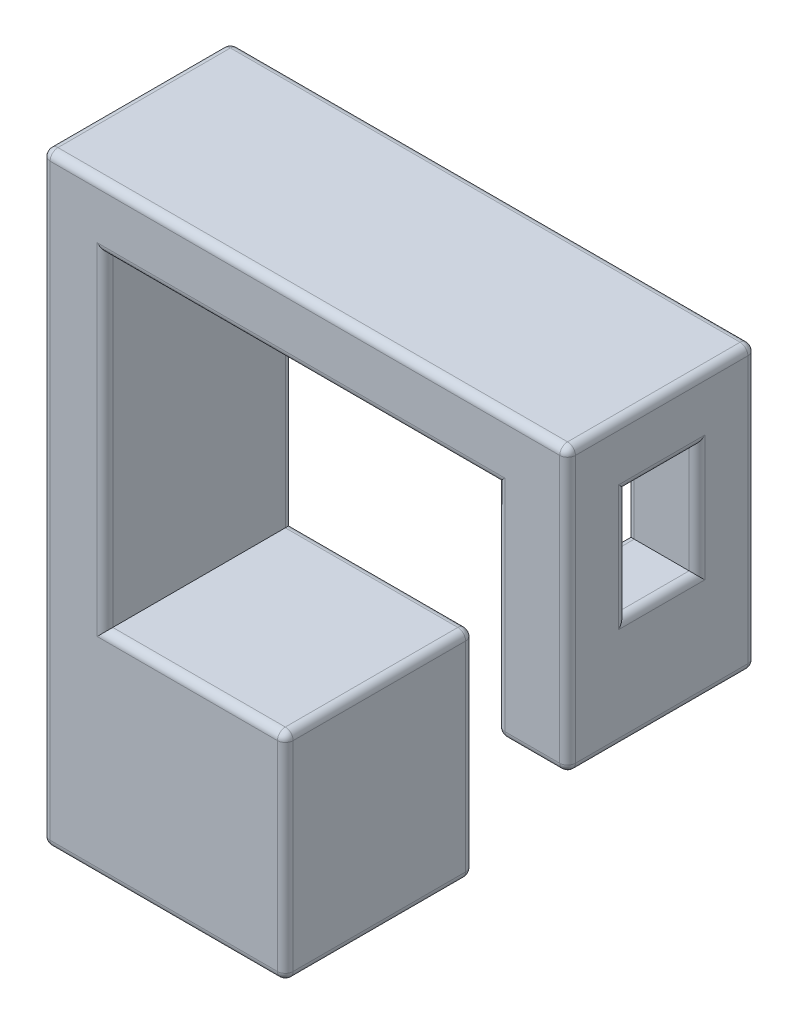
from build123d import *

# Parameters (mm, degrees)
BOSS_EXTRUDE1_DEPTH            = 12
F_4_8_4_8_DIAMETER_HOLE1_D     = 4.8
F_4_8_4_8_DIAMETER_HOLE1_DEPTH = 8
F_4_8_4_8_DIAMETER_HOLE1_TIP   = 1.442065486
F_4_8_4_8_DIAMETER_HOLE2_D     = 4.8
F_4_8_4_8_DIAMETER_HOLE2_DEPTH = 8
F_4_8_4_8_DIAMETER_HOLE2_TIP   = 1.442065486
CUT_EXTRUDE1_REACH             = 104.772
SKETCH11_W                     = 9
SKETCH11_H                     = 14
FILLET1_R                      = 1


with BuildPart() as part:
    # Sketch1 → Boss-Extrude1 (new, symmetric)
    with BuildSketch(Plane.XY):
        Polygon((0, 0), (-23, 0), (-31, 0), (-31, 77), (-23.404895261, 77), (36, 77), (36, 41), (27, 41), (27, 69), (-23, 69), (-23, 27.5), (0, 27.5), align=None)
    extrude(amount=BOSS_EXTRUDE1_DEPTH, both=True)

    # Ø4.8 (4.8) Diameter Hole1
    with Locations(Plane(origin=(0, 41, 0), x_dir=(-1, 0, 0), z_dir=(0, -1, 0))):
        with Locations((-31.3, 4.875), (-31.3, -4.875)):
            Hole(F_4_8_4_8_DIAMETER_HOLE1_D / 2, depth=F_4_8_4_8_DIAMETER_HOLE1_DEPTH)
            with Locations((0, 0, -(F_4_8_4_8_DIAMETER_HOLE1_DEPTH + F_4_8_4_8_DIAMETER_HOLE1_TIP / 2))):  # 118° drill point
                Cone(0, F_4_8_4_8_DIAMETER_HOLE1_D / 2, F_4_8_4_8_DIAMETER_HOLE1_TIP, mode=Mode.SUBTRACT)

    # Ø4.8 (4.8) Diameter Hole2
    with Locations(Plane(origin=(0, 0, 0), x_dir=(-1, 0, 0), z_dir=(0, -1, 0))):
        with Locations((5.95, 0), (21.95, 0)):
            Hole(F_4_8_4_8_DIAMETER_HOLE2_D / 2, depth=F_4_8_4_8_DIAMETER_HOLE2_DEPTH)
            with Locations((0, 0, -(F_4_8_4_8_DIAMETER_HOLE2_DEPTH + F_4_8_4_8_DIAMETER_HOLE2_TIP / 2))):  # 118° drill point
                Cone(0, F_4_8_4_8_DIAMETER_HOLE2_D / 2, F_4_8_4_8_DIAMETER_HOLE2_TIP, mode=Mode.SUBTRACT)

    # Sketch11 → Cut-Extrude1 (cut, up to next)
    with BuildSketch(Plane(origin=(36, 0, 0), x_dir=(0, 0, -1), z_dir=(1, 0, 0)), mode=Mode.PRIVATE) as cut_extrude1_sk1:
        with Locations((0, 62)):
            Rectangle(SKETCH11_W, SKETCH11_H)
    cut_extrude1_tool1 = extrude(cut_extrude1_sk1.sketch, amount=-CUT_EXTRUDE1_REACH, mode=Mode.PRIVATE) & part.part
    add(cut_extrude1_tool1.solids().sort_by_distance((36, 62, 0))[0], mode=Mode.SUBTRACT)

    # Fillet1
    fillet1_edges = [part.edges().sort_by_distance(p)[0] for p in [
        (-15.5, 0, -12),
        (-23, 48.25, 12),
        (-31, 38.5, -12),
        (2.5, 77, -12),
        (36, 59, -12),
        (31.5, 41, -12),
        (27, 55, -12),
        (2, 69, -12),
        (-23, 48.25, -12),
        (-11.5, 27.5, -12),
        (0, 13.75, -12),
        (2, 69, 12),
        (0, 0, 0),
        (-31, 0, 0),
        (27, 55, 12),
        (-31, 77, 0),
        (36, 77, 0),
        (36, 41, 0),
        (27, 41, 0),
        (0, 27.5, 0),
        (31.5, 41, 12),
        (36, 59, 12),
        (2.5, 77, 12),
        (-31, 38.5, 12),
        (-15.5, 0, 12),
        (0, 13.75, 12),
        (36, 62, 4.5),
        (36, 55, 0),
        (36, 62, -4.5),
        (36, 69, 0),
        (27, 55, 0),
        (27, 62, 4.5),
        (27, 62, -4.5),
        (-11.5, 27.5, 12),
    ]]
    fillet(fillet1_edges, radius=FILLET1_R)


solid = part.part
